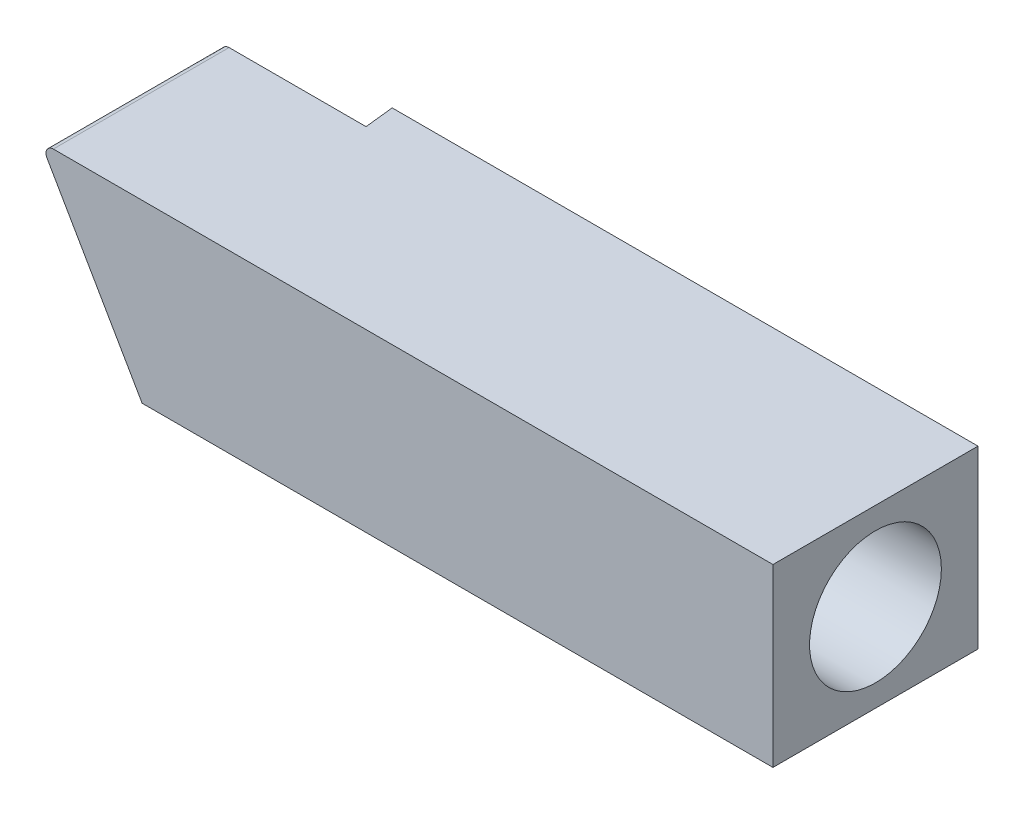
from build123d import *

# Parameters (mm, degrees)
EXTRUDE1_DEPTH     = 14
CUT_EXTRUDE1_DEPTH = 14
FILLET1_R          = 0.5
SKETCH3_R          = 4.5
CUT_EXTRUDE2_DEPTH = 25


with BuildPart() as part:
    # Sketch1 → Extrude1 (new body)
    with BuildSketch(Plane.XY):
        Polygon((-22.646297813, 12), (27.353702187, 12), (27.353702187, 0), (-15.718094583, 0), align=None)
    extrude(amount=EXTRUDE1_DEPTH)

    # Sketch2 → Cut-Extrude1 (cut)
    with BuildSketch(Plane(origin=(0, 12, 0), x_dir=(1, 0, 0), z_dir=(0, 1, 0))):
        Polygon((-22.646297813, -2), (-12.427539106, -2), (-12.646297813, 0), (-22.646297813, 0), align=None)
    extrude(amount=-CUT_EXTRUDE1_DEPTH, mode=Mode.SUBTRACT)

    # Fillet1
    fillet1_edges = [part.edges().sort_by_distance(p)[0] for p in [
        (-22.646297813, 12, 8),
    ]]
    fillet(fillet1_edges, radius=FILLET1_R)

    # Sketch3 → Cut-Extrude2 (cut)
    with BuildSketch(Plane(origin=(27.353702187, 0, 0), x_dir=(0, 0, -1), z_dir=(1, 0, 0))):
        with Locations((-7, 6)):
            Circle(SKETCH3_R)
    extrude(amount=-CUT_EXTRUDE2_DEPTH, mode=Mode.SUBTRACT)


solid = part.part
